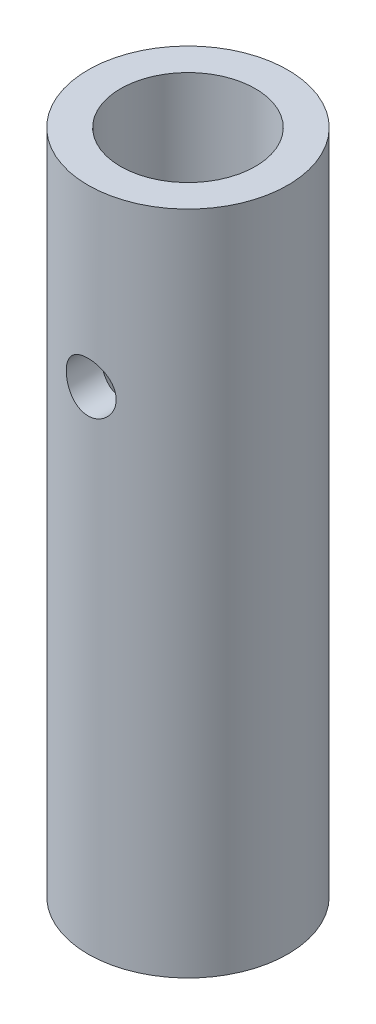
from build123d import *

# Parameters (mm, degrees)
SKETCH_1_R               = 6
SKETCH_1_R_2             = 4.05
EXTRUDE_1_DEPTH          = 40
CUT_EXTRUDE_1_DEPTH      = 41.890096601
CUT_EXTRUDE_1_DEPTH_BACK = 41.890096601
SKETCH_2_R               = 1.5


with BuildPart() as part:
    # 草图1 → 凸台-拉伸1 (new body)
    with BuildSketch(Plane(origin=(0, 0, 0), x_dir=(1, 0, 0), z_dir=(0, 1, 0))):
        with Locations(Location((0, 0, 0), (0, 0, 270))):
            Circle(SKETCH_1_R)
        with Locations(Location((0, 0, 0), (0, 0, 270))):
            Circle(SKETCH_1_R_2, mode=Mode.SUBTRACT)
    extrude(amount=EXTRUDE_1_DEPTH)

    # 草图2 → 切除-拉伸1 (cut, two sides: drawn at the far end of the back side and taken through both)
    with BuildSketch(Plane.XY.offset(-CUT_EXTRUDE_1_DEPTH_BACK)):
        with Locations((0, 29.5)):
            Circle(SKETCH_2_R)
    extrude(amount=CUT_EXTRUDE_1_DEPTH + CUT_EXTRUDE_1_DEPTH_BACK, mode=Mode.SUBTRACT)


solid = part.part
